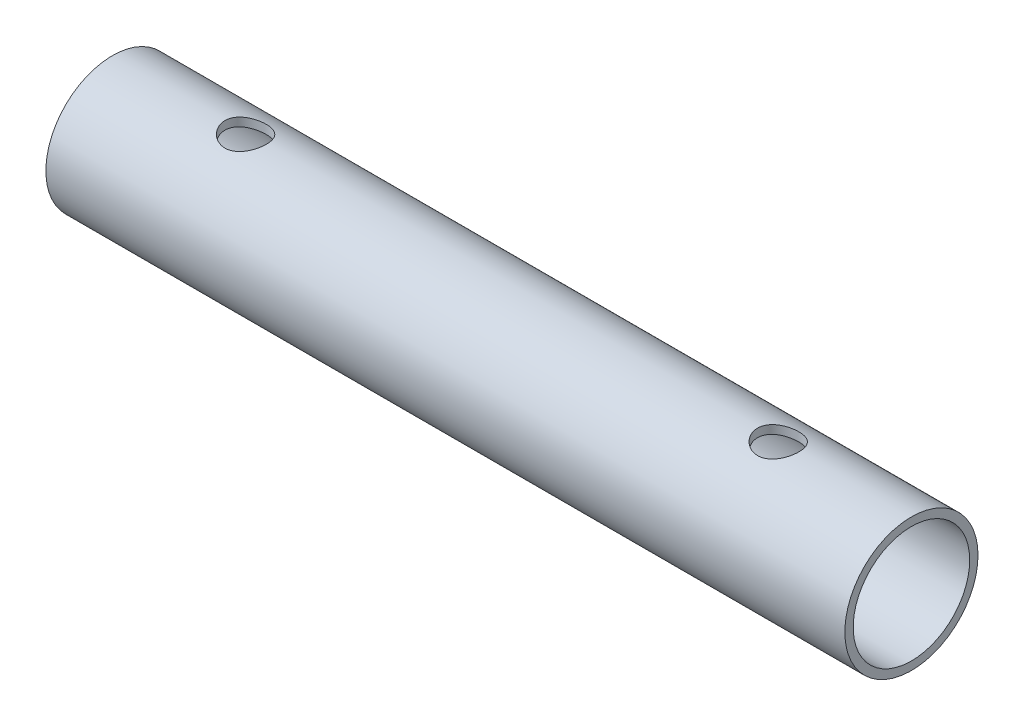
from build123d import *

# Parameters (mm, degrees)
SKETCH_1_R               = 10
SKETCH_1_R_2             = 8.75
EXTRUDE_1_DEPTH          = 120
CUT_EXTRUDE_1_DEPTH      = 121.830459736
CUT_EXTRUDE_1_DEPTH_BACK = 121.830459736
SKETCH_2_R               = 3.1


with BuildPart() as part:
    # 草图1 → 凸台-拉伸1 (new body)
    with BuildSketch(Plane(origin=(0, 0, 0), x_dir=(0, 0, -1), z_dir=(1, 0, 0))):
        Circle(SKETCH_1_R)
        Circle(SKETCH_1_R_2, mode=Mode.SUBTRACT)
    extrude(amount=EXTRUDE_1_DEPTH)

    # 草图2 → 切除-拉伸1 (cut, two sides: drawn at the far end of the back side and taken through both)
    with BuildSketch(Plane(origin=(0, 0, 0), x_dir=(1, 0, 0), z_dir=(0, 1, 0)).offset(-CUT_EXTRUDE_1_DEPTH_BACK)):
        with Locations(Location((20, 0, 0), (0, 0, 270))):
            Circle(SKETCH_2_R)
        with Locations(Location((100, 0, 0), (0, 0, 270))):
            Circle(SKETCH_2_R)
    extrude(amount=CUT_EXTRUDE_1_DEPTH + CUT_EXTRUDE_1_DEPTH_BACK, mode=Mode.SUBTRACT)


solid = part.part
